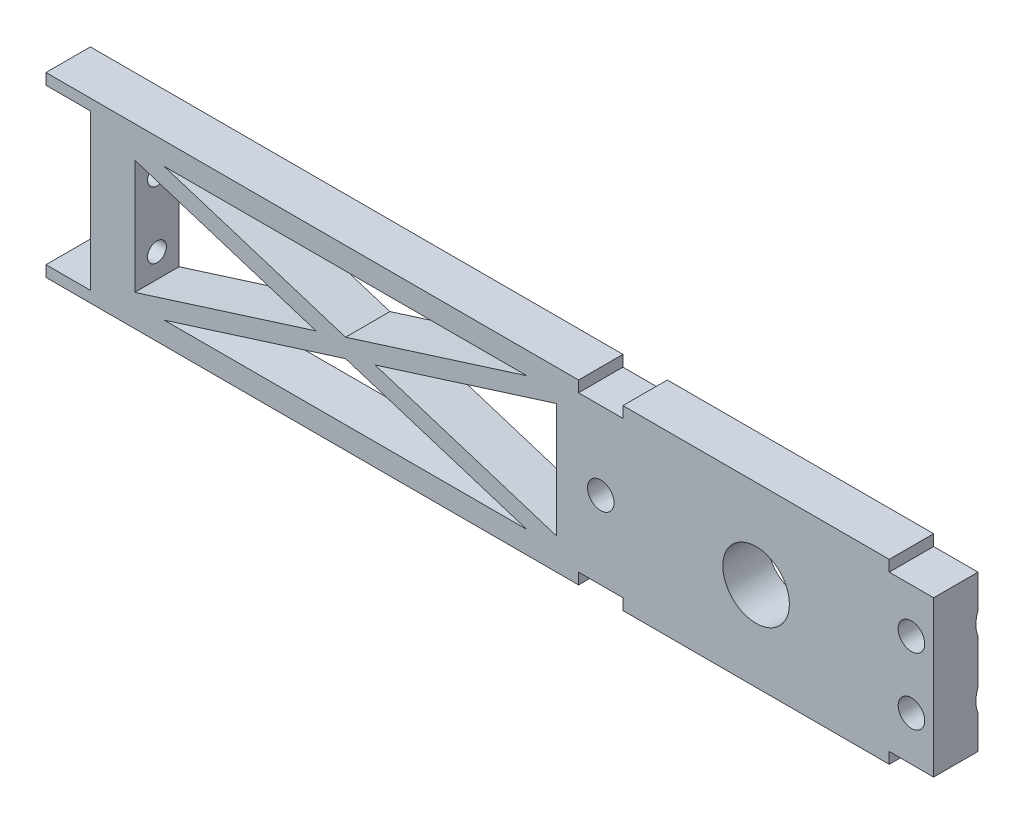
from build123d import *

# Parameters (mm, degrees)
SKETCH1_W                                         = 127
SKETCH1_H                                         = 25.4
SKETCH1_R                                         = 4.7625
BOSS_EXTRUDE1_DEPTH                               = 6.35
CSK_FOR_6_FLAT_HEAD_MACHINE_SCREW_100_D           = 3.7973
CSK_FOR_6_FLAT_HEAD_MACHINE_SCREW_100_CSINK_D     = 7.0866
CSK_FOR_6_FLAT_HEAD_MACHINE_SCREW_100_CSINK_ANGLE = 100
SKETCH5_W                                         = 6.35
SKETCH5_H                                         = 22.225
CUT_EXTRUDE1_DEPTH                                = 103.587389576
SKETCH6_W                                         = 6.35
SKETCH6_H                                         = 1.5875
CUT_EXTRUDE2_DEPTH                                = 103.587389576
TAP_DRILL_FOR_6_32_TAP1_D                         = 2.7051
TAP_DRILL_FOR_6_32_TAP1_DEPTH                     = 6.35
TAP_DRILL_FOR_6_32_TAP1_TIP                       = 0.81269403


with BuildPart() as part:
    # Sketch1 → Boss-Extrude1 (new body)
    with BuildSketch(Plane.XY):
        with Locations((-38.1, 0)):
            Rectangle(SKETCH1_W, SKETCH1_H)
        Polygon((-88.9, 8.193180488), (-62.954928456, 0), (-88.9, -8.193180488), align=None, mode=Mode.SUBTRACT)
        Polygon((-84.682571544, -9.525), (-58.7375, -1.331819512), (-32.792428456, -9.525), align=None, mode=Mode.SUBTRACT)
        Polygon((-28.575, -8.193180488), (-54.520071544, 0), (-28.575, 8.193180488), align=None, mode=Mode.SUBTRACT)
        Polygon((-32.792428456, 9.525), (-58.7375, 1.331819512), (-84.682571544, 9.525), align=None, mode=Mode.SUBTRACT)
        Circle(SKETCH1_R, mode=Mode.SUBTRACT)
    extrude(amount=BOSS_EXTRUDE1_DEPTH)

    # CSK for #6 Flat Head Machine Screw (100)1 (through all)
    with Locations(Plane(origin=(0, 0, 0), x_dir=(-1, 0, 0), z_dir=(0, 0, -1))):
        with Locations((-22.225, 4.7625), (-22.225, -4.7625), (22.225, 0)):
            CounterSinkHole(CSK_FOR_6_FLAT_HEAD_MACHINE_SCREW_100_D / 2, CSK_FOR_6_FLAT_HEAD_MACHINE_SCREW_100_CSINK_D / 2, counter_sink_angle=CSK_FOR_6_FLAT_HEAD_MACHINE_SCREW_100_CSINK_ANGLE)

    # Sketch5 → Cut-Extrude1 (cut, through all)
    with BuildSketch(Plane(origin=(0, 0, 0), x_dir=(-1, 0, 0), z_dir=(0, 0, -1))):
        with Locations((98.425, 0)):
            Rectangle(SKETCH5_W, SKETCH5_H)
    extrude(amount=-CUT_EXTRUDE1_DEPTH, mode=Mode.SUBTRACT)

    # Sketch6 → Cut-Extrude2 (cut, through all)
    with BuildSketch(Plane(origin=(0, 0, 0), x_dir=(-1, 0, 0), z_dir=(0, 0, -1))):
        with Locations((22.225, 11.90625)):
            Rectangle(SKETCH6_W, SKETCH6_H)
        with Locations((-22.225, 11.90625)):
            Rectangle(SKETCH6_W, SKETCH6_H)
    cut_extrude2 = extrude(amount=-CUT_EXTRUDE2_DEPTH, mode=Mode.SUBTRACT)

    # Mirror3: Cut-Extrude2 across plane
    add(cut_extrude2.mirror(Plane(origin=(0, 0, 0), x_dir=(0, 0, 1), z_dir=(0, -1, 0))), mode=Mode.SUBTRACT)

    # Tap Drill for #6-32 Tap1
    with Locations(Plane.ZY.offset(95.25)):
        with Locations((3.175, 4.7625), (3.175, -4.7625)):
            Hole(TAP_DRILL_FOR_6_32_TAP1_D / 2, depth=TAP_DRILL_FOR_6_32_TAP1_DEPTH)
            with Locations((0, 0, -(TAP_DRILL_FOR_6_32_TAP1_DEPTH + TAP_DRILL_FOR_6_32_TAP1_TIP / 2))):  # 118° drill point
                Cone(0, TAP_DRILL_FOR_6_32_TAP1_D / 2, TAP_DRILL_FOR_6_32_TAP1_TIP, mode=Mode.SUBTRACT)


solid = part.part
